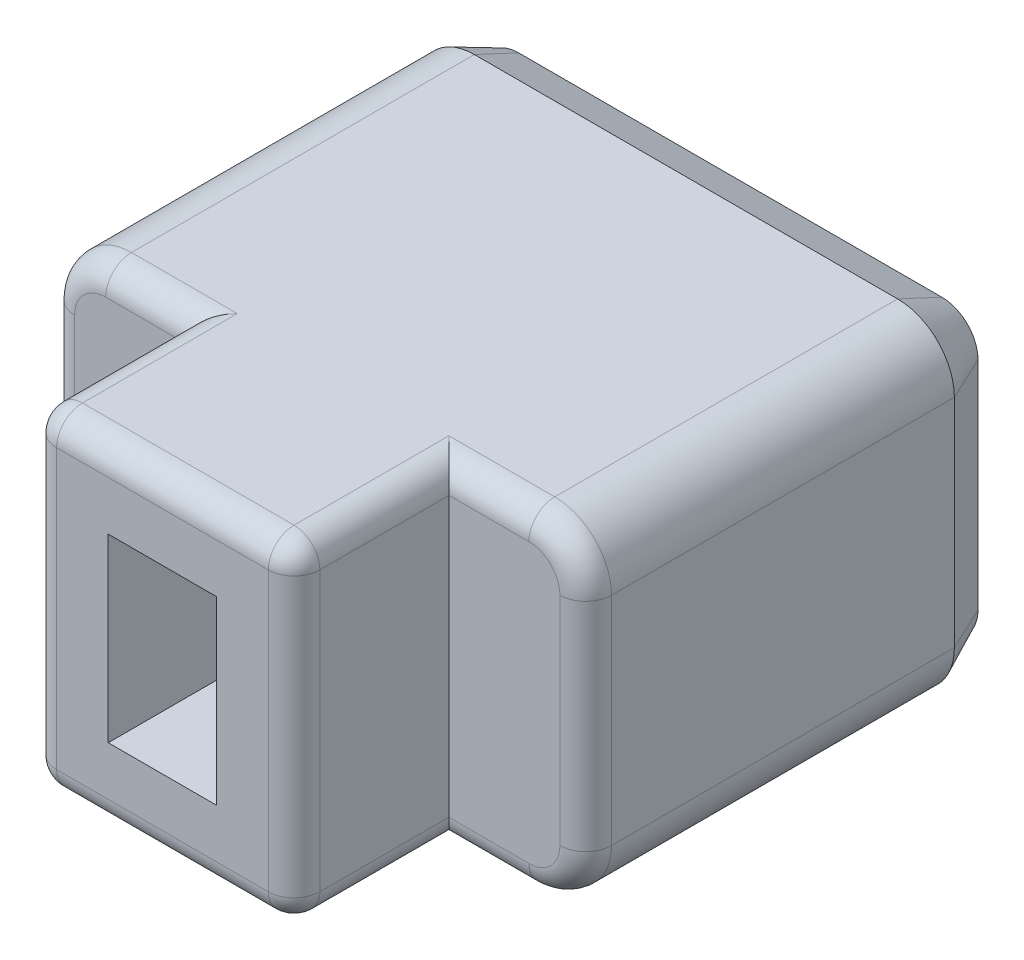
from build123d import *

# Parameters (mm, degrees)
BOSS_EXTRU_1_DEPTH      = 11
ESQUISSE3_W             = 2.1
ESQUISSE3_H             = 3.5
ENL_V_MAT_EXTRU_1_DEPTH = 3
ESQUISSE4_OUTSIDE_W     = 15.688
ESQUISSE4_OUTSIDE_H     = 11.688
ESQUISSE4_OUTSIDE_W_2   = 5.1
ESQUISSE4_OUTSIDE_H_2   = 6.4
ENL_V_MAT_EXTRU_2_DEPTH = 3
CONG_1_R                = 0.5
CHANFREIN1_SIZE         = 0.4
CHANFREIN1_SIZE2        = 0.857802768
ENL_V_MAT_EXTRU_3_DEPTH = 0.3
BOSS_EXTRU_2_DEPTH      = 0.3


with BuildPart() as part:
    # Esquisse2 → Boss.-Extru.1 (new body)
    with BuildSketch(Plane.XY):
        with BuildLine():
            Line((1.1, 0), (9.3, 0))
            ThreePointArc((9.3, 0), (10.077817459, 0.322182541), (10.4, 1.1))
            Line((10.4, 1.1), (10.4, 5.3))
            ThreePointArc((10.4, 5.3), (10.077817459, 6.077817459), (9.3, 6.4))
            Line((9.3, 6.4), (1.1, 6.4))
            ThreePointArc((1.1, 6.4), (0.322182541, 6.077817459), (0, 5.3))
            Line((0, 5.3), (0, 1.1))
            ThreePointArc((0, 1.1), (0.322182541, 0.322182541), (1.1, 0))
        make_face()
    extrude(amount=BOSS_EXTRU_1_DEPTH)

    # Esquisse3 → Enlèv. mat.-Extru.1 (cut)
    with BuildSketch(Plane.XY.offset(11)):
        with Locations((5.2, 3.2)):
            Rectangle(ESQUISSE3_W, ESQUISSE3_H)
    extrude(amount=-ENL_V_MAT_EXTRU_1_DEPTH, mode=Mode.SUBTRACT)

    # Esquisse4 outside → Enlèv. mat.-Extru.2 (cut)
    with BuildSketch(Plane.XY.offset(11)):
        with Locations((5.2, 3.2)):
            Rectangle(ESQUISSE4_OUTSIDE_W, ESQUISSE4_OUTSIDE_H)
        with Locations((5.2, 3.2)):
            Rectangle(ESQUISSE4_OUTSIDE_W_2, ESQUISSE4_OUTSIDE_H_2, mode=Mode.SUBTRACT)
    extrude(amount=-ENL_V_MAT_EXTRU_2_DEPTH, mode=Mode.SUBTRACT)

    # Congé1
    cong_1_edges = [part.edges().sort_by_distance(p)[0] for p in [
        (8.525, 0, 8),
        (10.077817459, 0.322182541, 8),
        (10.4, 3.2, 8),
        (10.077817459, 6.077817459, 8),
        (1.875, 6.4, 8),
        (0.322182541, 6.077817459, 8),
        (1.875, 0, 8),
        (0.322182541, 0.322182541, 8),
        (7.75, 6.4, 9.5),
        (2.65, 6.4, 9.5),
        (7.75, 0, 9.5),
        (2.65, 0, 9.5),
        (2.65, 3.2, 11),
        (5.2, 6.4, 11),
        (7.75, 3.2, 11),
        (5.2, 0, 11),
        (8.525, 6.4, 8),
        (0, 3.2, 8),
    ]]
    fillet(cong_1_edges, radius=CONG_1_R)

    # Chanfrein1
    chanfrein1_edges = [part.edges().sort_by_distance(p)[0] for p in [
        (5.2, 0, 0),
        (10.077817459, 0.322182541, 0),
        (0.322182541, 0.322182541, 0),
        (10.4, 3.2, 0),
        (0, 3.2, 0),
        (10.077817459, 6.077817459, 0),
        (0.322182541, 6.077817459, 0),
        (5.2, 6.4, 0),
    ]]
    chanfrein1_side = [part.faces().sort_by_distance(p)[0] for p in [
        (5.2, 3.2, 0),
    ]]
    chamfer(chanfrein1_edges, length=CHANFREIN1_SIZE, length2=CHANFREIN1_SIZE2, reference=chanfrein1_side[0])

    # Esquisse5 → Enlèv. mat.-Extru.3 (cut)
    with BuildSketch(Plane(origin=(0, 0, 0), x_dir=(-1, 0, 0), z_dir=(0, 0, -1))):
        with BuildLine():
            Line((-5.61025641, 1.197435897), (-5.905929487, 1.42900641))
            Line((-5.905929487, 1.42900641), (-4.983653846, 3.041185897))
            add(Edge.make_bspline(
                [(-4.983653846, 3.041185897), (-5.014818835, 3.033573937), (-5.075724224, 3.018697967), (-5.16649261, 3.003606868), (-5.254031024, 2.994460036), (-5.311357697, 2.993015092), (-5.339423077, 2.992307692)],
                knots=[0, 0, 0, 0, 1.069017442, 2.089168874, 3.064515738, 4, 4, 4, 4], degree=3))
            add(Edge.make_bspline(
                [(-5.339423077, 2.992307692), (-5.373140867, 2.993423536), (-5.439890887, 2.995632537), (-5.537749929, 3.012049254), (-5.631973031, 3.038534865), (-5.721932526, 3.076557411), (-5.808189439, 3.124953148), (-5.890585673, 3.184165695), (-5.969045058, 3.253925599), (-6.042217241, 3.333938364), (-6.109038627, 3.421339006), (-6.1676878, 3.514702352), (-6.218086342, 3.612834773), (-6.257376136, 3.716653867), (-6.290296552, 3.824566528), (-6.312381402, 3.937866744), (-6.325142567, 4.056115466), (-6.327172474, 4.136507023), (-6.328205128, 4.177403846)],
                knots=[0, 0, 0, 0, 0.942553966, 1.865943652, 2.766733261, 3.673940853, 4.590204225, 5.527059003, 6.505849152, 7.52076352, 8.554521604, 9.578220193, 10.600364479, 11.633717745, 12.678213115, 13.751916221, 14.856353979, 16, 16, 16, 16], degree=3))
            add(Edge.make_bspline(
                [(-6.328205128, 4.177403846), (-6.326603403, 4.233341954), (-6.323457899, 4.343194447), (-6.29599668, 4.503355096), (-6.253231723, 4.655751293), (-6.190912682, 4.798322672), (-6.114077348, 4.93060133), (-6.020595441, 5.048834763), (-5.913266673, 5.15342069), (-5.791836733, 5.241617679), (-5.660942196, 5.31293055), (-5.523338908, 5.365037204), (-5.380361692, 5.396398228), (-5.283218086, 5.400503426), (-5.234455128, 5.402564103)],
                knots=[0, 0, 0, 0, 1.100056568, 2.160315386, 3.188427629, 4.207809803, 5.213838152, 6.190705293, 7.164584177, 8.153872716, 9.134634922, 10.08940477, 11.040942793, 12, 12, 12, 12], degree=3))
            add(Edge.make_bspline(
                [(-5.234455128, 5.402564103), (-5.187289577, 5.400804731), (-5.093607835, 5.397310209), (-4.95608243, 5.36644897), (-4.823950155, 5.31613533), (-4.698529119, 5.246430495), (-4.5824853, 5.158943023), (-4.477303826, 5.055483755), (-4.387894828, 4.933817109), (-4.311569467, 4.798943106), (-4.249896696, 4.654164091), (-4.206905649, 4.501980935), (-4.17924905, 4.345077735), (-4.175998579, 4.23841716), (-4.174358974, 4.184615385)],
                knots=[0, 0, 0, 0, 0.944514783, 1.876025815, 2.809749976, 3.770782873, 4.742022766, 5.715017251, 6.717312799, 7.757958031, 8.816032333, 9.86330905, 10.922209375, 12, 12, 12, 12], degree=3))
            add(Edge.make_bspline(
                [(-4.174358974, 4.184615385), (-4.175539059, 4.1434346), (-4.177945878, 4.059445151), (-4.194748365, 3.932211398), (-4.22117984, 3.801729548), (-4.259746448, 3.666466508), (-4.312008113, 3.523003895), (-4.380147376, 3.367633901), (-4.465304201, 3.198803446), (-4.530930712, 3.08336275), (-4.565384615, 3.02275641)],
                knots=[0, 0, 0, 0, 0.796645725, 1.62478291, 2.479141068, 3.370698376, 4.343336413, 5.431070381, 6.651312523, 8, 8, 8, 8], degree=3))
            Line((-4.565384615, 3.02275641), (-5.61025641, 1.197435897))
        make_face()
        with BuildLine():
            add(Edge.make_bspline(
                [(-5.250480769, 3.402564103), (-5.22614592, 3.403467511), (-5.178058902, 3.405252698), (-5.107226303, 3.415410165), (-5.039333151, 3.434231439), (-4.974463413, 3.459999012), (-4.911795821, 3.492179907), (-4.852533717, 3.53277955), (-4.795445049, 3.580046319), (-4.742383794, 3.634308875), (-4.693533137, 3.693503216), (-4.650317007, 3.756366242), (-4.614060539, 3.822762408), (-4.583963734, 3.891800104), (-4.562007602, 3.964582469), (-4.544766662, 4.039708835), (-4.535124033, 4.118392084), (-4.533938812, 4.171769977), (-4.533333333, 4.199038462)],
                knots=[0, 0, 0, 0, 0.980450227, 1.937424298, 2.874354807, 3.811285315, 4.74475074, 5.705526773, 6.698643629, 7.725619579, 8.757317799, 9.78677002, 10.793026747, 11.800203164, 12.81419361, 13.850369222, 14.901845495, 16, 16, 16, 16], degree=3))
            add(Edge.make_bspline(
                [(-4.533333333, 4.199038462), (-4.533945723, 4.226040817), (-4.535150268, 4.27915335), (-4.544762963, 4.357291393), (-4.56173668, 4.432076406), (-4.585170129, 4.503921184), (-4.614748087, 4.572958359), (-4.651060295, 4.638900636), (-4.69362065, 4.701985458), (-4.743259874, 4.760286778), (-4.796207673, 4.81484218), (-4.853304698, 4.862169047), (-4.912850799, 4.902453612), (-4.974844876, 4.936065638), (-5.040357398, 4.960354501), (-5.107992206, 4.979546841), (-5.178869362, 4.989596991), (-5.226950286, 4.991396855), (-5.251282051, 4.992307692)],
                knots=[0, 0, 0, 0, 1.089802191, 2.143596548, 3.171536916, 4.180760996, 5.190157834, 6.198632954, 7.21537346, 8.256237336, 9.285477357, 10.280783638, 11.243677797, 12.184220045, 13.119308391, 14.058304456, 15.017388272, 16, 16, 16, 16], degree=3))
            add(Edge.make_bspline(
                [(-5.251282051, 4.992307692), (-5.275614239, 4.991397667), (-5.323695999, 4.989599407), (-5.394567048, 4.979537527), (-5.462224448, 4.96038858), (-5.527874618, 4.935855802), (-5.590376339, 4.902699616), (-5.650058395, 4.862148422), (-5.70710423, 4.814804415), (-5.76021125, 4.760588944), (-5.80878233, 4.701456026), (-5.852400301, 4.639172859), (-5.888755551, 4.573111942), (-5.917197304, 4.503729433), (-5.940890098, 4.432101693), (-5.957783843, 4.357284414), (-5.967418378, 4.279155183), (-5.968619911, 4.226041435), (-5.969230769, 4.199038462)],
                knots=[0, 0, 0, 0, 0.982333901, 1.941146542, 2.879877112, 3.814701068, 4.764504859, 5.727126766, 6.722151631, 7.751100641, 8.784780994, 9.807330688, 10.815520668, 11.820421087, 12.829359816, 13.85700954, 14.910505944, 16, 16, 16, 16], degree=3))
            add(Edge.make_bspline(
                [(-5.969230769, 4.199038462), (-5.968633558, 4.171767178), (-5.967464521, 4.118383805), (-5.957705027, 4.039740124), (-5.940877234, 3.964389102), (-5.917348839, 3.892163474), (-5.888775088, 3.822541836), (-5.852159038, 3.756401041), (-5.809053135, 3.693496325), (-5.760180782, 3.634301217), (-5.707095489, 3.580083112), (-5.649948669, 3.532504726), (-5.590074281, 3.492413923), (-5.527319086, 3.459979902), (-5.462200532, 3.434081118), (-5.393970011, 3.415529295), (-5.322908067, 3.405231406), (-5.274817443, 3.403460357), (-5.250480769, 3.402564103)],
                knots=[0, 0, 0, 0, 1.096895977, 2.147167217, 3.182155332, 4.198227678, 5.200051705, 6.205155221, 7.233427651, 8.263943504, 9.2897425, 10.281721205, 11.250318538, 12.182714176, 13.118570925, 14.064796065, 15.020673407, 16, 16, 16, 16], degree=3))
        make_face(mode=Mode.SUBTRACT)
    extrude(amount=-ENL_V_MAT_EXTRU_3_DEPTH, mode=Mode.SUBTRACT)


with BuildPart() as body_2:
    # Esquisse5<2> → Boss.-Extru.2 (new body)
    with BuildSketch(Plane(origin=(0, 0, 0), x_dir=(-1, 0, 0), z_dir=(0, 0, -1))):
        with BuildLine():
            Line((-5.61025641, 1.197435897), (-5.905929487, 1.42900641))
            Line((-5.905929487, 1.42900641), (-4.983653846, 3.041185897))
            add(Edge.make_bspline(
                [(-4.983653846, 3.041185897), (-5.014818835, 3.033573937), (-5.075724224, 3.018697967), (-5.16649261, 3.003606868), (-5.254031024, 2.994460036), (-5.311357697, 2.993015092), (-5.339423077, 2.992307692)],
                knots=[0, 0, 0, 0, 1.069017442, 2.089168874, 3.064515738, 4, 4, 4, 4], degree=3))
            add(Edge.make_bspline(
                [(-5.339423077, 2.992307692), (-5.373140867, 2.993423536), (-5.439890887, 2.995632537), (-5.537749929, 3.012049254), (-5.631973031, 3.038534865), (-5.721932526, 3.076557411), (-5.808189439, 3.124953148), (-5.890585673, 3.184165695), (-5.969045058, 3.253925599), (-6.042217241, 3.333938364), (-6.109038627, 3.421339006), (-6.1676878, 3.514702352), (-6.218086342, 3.612834773), (-6.257376136, 3.716653867), (-6.290296552, 3.824566528), (-6.312381402, 3.937866744), (-6.325142567, 4.056115466), (-6.327172474, 4.136507023), (-6.328205128, 4.177403846)],
                knots=[0, 0, 0, 0, 0.942553966, 1.865943652, 2.766733261, 3.673940853, 4.590204225, 5.527059003, 6.505849152, 7.52076352, 8.554521604, 9.578220193, 10.600364479, 11.633717745, 12.678213115, 13.751916221, 14.856353979, 16, 16, 16, 16], degree=3))
            add(Edge.make_bspline(
                [(-6.328205128, 4.177403846), (-6.326603403, 4.233341954), (-6.323457899, 4.343194447), (-6.29599668, 4.503355096), (-6.253231723, 4.655751293), (-6.190912682, 4.798322672), (-6.114077348, 4.93060133), (-6.020595441, 5.048834763), (-5.913266673, 5.15342069), (-5.791836733, 5.241617679), (-5.660942196, 5.31293055), (-5.523338908, 5.365037204), (-5.380361692, 5.396398228), (-5.283218086, 5.400503426), (-5.234455128, 5.402564103)],
                knots=[0, 0, 0, 0, 1.100056568, 2.160315386, 3.188427629, 4.207809803, 5.213838152, 6.190705293, 7.164584177, 8.153872716, 9.134634922, 10.08940477, 11.040942793, 12, 12, 12, 12], degree=3))
            add(Edge.make_bspline(
                [(-5.234455128, 5.402564103), (-5.187289577, 5.400804731), (-5.093607835, 5.397310209), (-4.95608243, 5.36644897), (-4.823950155, 5.31613533), (-4.698529119, 5.246430495), (-4.5824853, 5.158943023), (-4.477303826, 5.055483755), (-4.387894828, 4.933817109), (-4.311569467, 4.798943106), (-4.249896696, 4.654164091), (-4.206905649, 4.501980935), (-4.17924905, 4.345077735), (-4.175998579, 4.23841716), (-4.174358974, 4.184615385)],
                knots=[0, 0, 0, 0, 0.944514783, 1.876025815, 2.809749976, 3.770782873, 4.742022766, 5.715017251, 6.717312799, 7.757958031, 8.816032333, 9.86330905, 10.922209375, 12, 12, 12, 12], degree=3))
            add(Edge.make_bspline(
                [(-4.174358974, 4.184615385), (-4.175539059, 4.1434346), (-4.177945878, 4.059445151), (-4.194748365, 3.932211398), (-4.22117984, 3.801729548), (-4.259746448, 3.666466508), (-4.312008113, 3.523003895), (-4.380147376, 3.367633901), (-4.465304201, 3.198803446), (-4.530930712, 3.08336275), (-4.565384615, 3.02275641)],
                knots=[0, 0, 0, 0, 0.796645725, 1.62478291, 2.479141068, 3.370698376, 4.343336413, 5.431070381, 6.651312523, 8, 8, 8, 8], degree=3))
            Line((-4.565384615, 3.02275641), (-5.61025641, 1.197435897))
        make_face()
        with BuildLine():
            add(Edge.make_bspline(
                [(-5.250480769, 3.402564103), (-5.22614592, 3.403467511), (-5.178058902, 3.405252698), (-5.107226303, 3.415410165), (-5.039333151, 3.434231439), (-4.974463413, 3.459999012), (-4.911795821, 3.492179907), (-4.852533717, 3.53277955), (-4.795445049, 3.580046319), (-4.742383794, 3.634308875), (-4.693533137, 3.693503216), (-4.650317007, 3.756366242), (-4.614060539, 3.822762408), (-4.583963734, 3.891800104), (-4.562007602, 3.964582469), (-4.544766662, 4.039708835), (-4.535124033, 4.118392084), (-4.533938812, 4.171769977), (-4.533333333, 4.199038462)],
                knots=[0, 0, 0, 0, 0.980450227, 1.937424298, 2.874354807, 3.811285315, 4.74475074, 5.705526773, 6.698643629, 7.725619579, 8.757317799, 9.78677002, 10.793026747, 11.800203164, 12.81419361, 13.850369222, 14.901845495, 16, 16, 16, 16], degree=3))
            add(Edge.make_bspline(
                [(-4.533333333, 4.199038462), (-4.533945723, 4.226040817), (-4.535150268, 4.27915335), (-4.544762963, 4.357291393), (-4.56173668, 4.432076406), (-4.585170129, 4.503921184), (-4.614748087, 4.572958359), (-4.651060295, 4.638900636), (-4.69362065, 4.701985458), (-4.743259874, 4.760286778), (-4.796207673, 4.81484218), (-4.853304698, 4.862169047), (-4.912850799, 4.902453612), (-4.974844876, 4.936065638), (-5.040357398, 4.960354501), (-5.107992206, 4.979546841), (-5.178869362, 4.989596991), (-5.226950286, 4.991396855), (-5.251282051, 4.992307692)],
                knots=[0, 0, 0, 0, 1.089802191, 2.143596548, 3.171536916, 4.180760996, 5.190157834, 6.198632954, 7.21537346, 8.256237336, 9.285477357, 10.280783638, 11.243677797, 12.184220045, 13.119308391, 14.058304456, 15.017388272, 16, 16, 16, 16], degree=3))
            add(Edge.make_bspline(
                [(-5.251282051, 4.992307692), (-5.275614239, 4.991397667), (-5.323695999, 4.989599407), (-5.394567048, 4.979537527), (-5.462224448, 4.96038858), (-5.527874618, 4.935855802), (-5.590376339, 4.902699616), (-5.650058395, 4.862148422), (-5.70710423, 4.814804415), (-5.76021125, 4.760588944), (-5.80878233, 4.701456026), (-5.852400301, 4.639172859), (-5.888755551, 4.573111942), (-5.917197304, 4.503729433), (-5.940890098, 4.432101693), (-5.957783843, 4.357284414), (-5.967418378, 4.279155183), (-5.968619911, 4.226041435), (-5.969230769, 4.199038462)],
                knots=[0, 0, 0, 0, 0.982333901, 1.941146542, 2.879877112, 3.814701068, 4.764504859, 5.727126766, 6.722151631, 7.751100641, 8.784780994, 9.807330688, 10.815520668, 11.820421087, 12.829359816, 13.85700954, 14.910505944, 16, 16, 16, 16], degree=3))
            add(Edge.make_bspline(
                [(-5.969230769, 4.199038462), (-5.968633558, 4.171767178), (-5.967464521, 4.118383805), (-5.957705027, 4.039740124), (-5.940877234, 3.964389102), (-5.917348839, 3.892163474), (-5.888775088, 3.822541836), (-5.852159038, 3.756401041), (-5.809053135, 3.693496325), (-5.760180782, 3.634301217), (-5.707095489, 3.580083112), (-5.649948669, 3.532504726), (-5.590074281, 3.492413923), (-5.527319086, 3.459979902), (-5.462200532, 3.434081118), (-5.393970011, 3.415529295), (-5.322908067, 3.405231406), (-5.274817443, 3.403460357), (-5.250480769, 3.402564103)],
                knots=[0, 0, 0, 0, 1.096895977, 2.147167217, 3.182155332, 4.198227678, 5.200051705, 6.205155221, 7.233427651, 8.263943504, 9.2897425, 10.281721205, 11.250318538, 12.182714176, 13.118570925, 14.064796065, 15.020673407, 16, 16, 16, 16], degree=3))
        make_face(mode=Mode.SUBTRACT)
    extrude(amount=BOSS_EXTRU_2_DEPTH)


solid = Compound([part.part, body_2.part])
